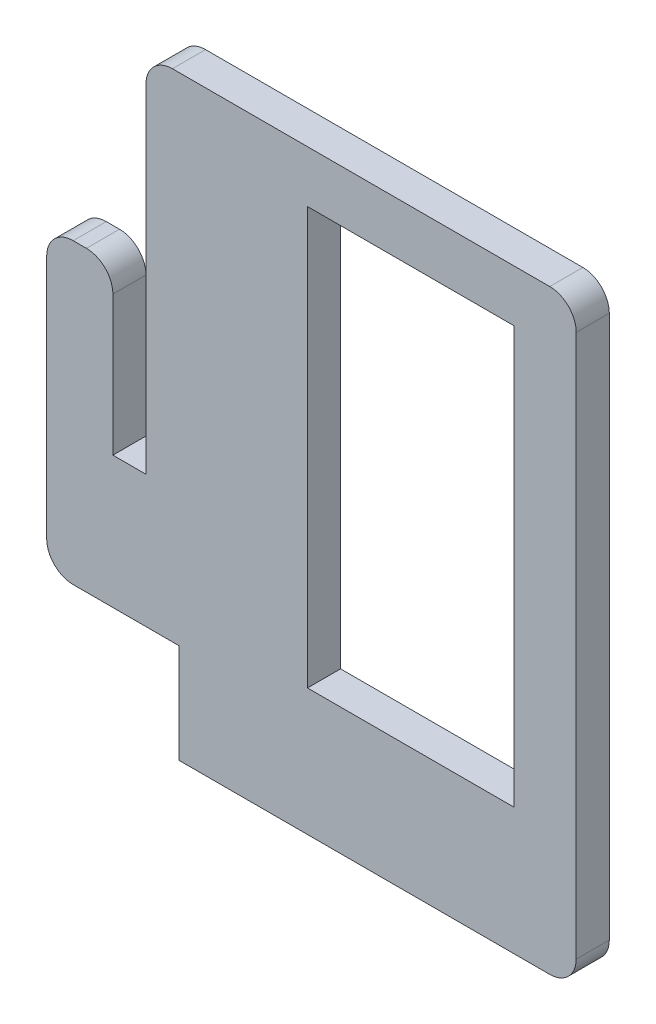
from build123d import *

# Parameters (mm, degrees)
SKETCH1_W           = 19.812
SKETCH1_H           = 40
BOSS_EXTRUDE1_DEPTH = 3.175
FILLET2_R           = 2.54


with BuildPart() as part:
    # Sketch1 → Boss-Extrude1 (new body)
    with BuildSketch(Plane.XY):
        Polygon((12.7, 0), (50.8, 0), (50.8, 38.1), (50.8, 57.15), (9.525, 57.15), (9.525, 38.1), (9.525, 22.184785263), (6.35, 22.184785263), (6.35, 38.1), (0, 38.1), (0, 9.525), (12.7, 9.525), align=None)
        with Locations((34.925, 32.177185263)):
            Rectangle(SKETCH1_W, SKETCH1_H, mode=Mode.SUBTRACT)
    extrude(amount=BOSS_EXTRUDE1_DEPTH)

    # Fillet2
    fillet2_edges = [part.edges().sort_by_distance(p)[0] for p in [
        (50.8, 0, 1.5875),
        (0, 9.525, 1.5875),
        (0, 38.1, 1.5875),
        (6.35, 38.1, 1.5875),
        (9.525, 57.15, 1.5875),
        (50.8, 57.15, 1.5875),
    ]]
    fillet(fillet2_edges, radius=FILLET2_R)


solid = part.part
